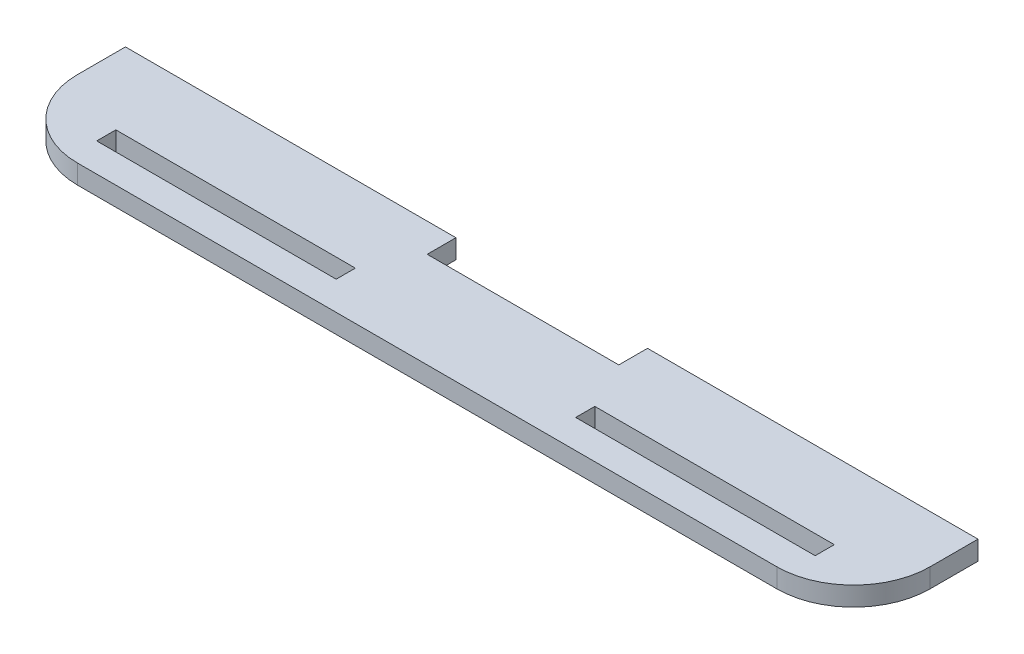
from build123d import *

# Parameters (mm, degrees)
ESTRUSIONE_ESTRUSIONE1_DEPTH      = 10
ESTRUSIONE_ESTRUSIONE1_DEPTH_BACK = 3
SCHIZZO1_W                        = 89
SCHIZZO1_H                        = 2
SCHIZZO2_W                        = 25
SCHIZZO2_H                        = 2
TAGLIO_ESTRUSIONE1_DEPTH          = 10
SCHIZZO3_W                        = 20
SCHIZZO3_H                        = 3
TAGLIO_ESTRUSIONE2_DEPTH          = 10
RACCORDO1_R                       = 8


with BuildPart() as part:
    # Schizzo1 → Estrusione-Estrusione1 (new, two sides: drawn at the far end of the back side and taken through both)
    with BuildSketch(Plane.XY.offset(-ESTRUSIONE_ESTRUSIONE1_DEPTH_BACK)):
        with Locations((0, 22.5)):
            Rectangle(SCHIZZO1_W, SCHIZZO1_H)
    extrude(amount=ESTRUSIONE_ESTRUSIONE1_DEPTH + ESTRUSIONE_ESTRUSIONE1_DEPTH_BACK)

    # Schizzo2 → Taglio-Estrusione1 (cut)
    with BuildSketch(Plane.XZ.offset(-21.5)):
        with Locations((-25, 6)):
            Rectangle(SCHIZZO2_W, SCHIZZO2_H)
        with Locations((25, 6)):
            Rectangle(SCHIZZO2_W, SCHIZZO2_H)
    extrude(amount=-TAGLIO_ESTRUSIONE1_DEPTH, mode=Mode.SUBTRACT)

    # Schizzo3 → Taglio-Estrusione2 (cut)
    with BuildSketch(Plane(origin=(0, 23.5, 0), x_dir=(1, 0, 0), z_dir=(0, 1, 0))):
        with Locations((0, 1.5)):
            Rectangle(SCHIZZO3_W, SCHIZZO3_H)
    extrude(amount=-TAGLIO_ESTRUSIONE2_DEPTH, mode=Mode.SUBTRACT)

    # Raccordo1
    raccordo1_edges = [part.edges().sort_by_distance(p)[0] for p in [
        (-44.5, 22.5, 10),
        (44.5, 22.5, 10),
    ]]
    fillet(raccordo1_edges, radius=RACCORDO1_R)


solid = part.part
